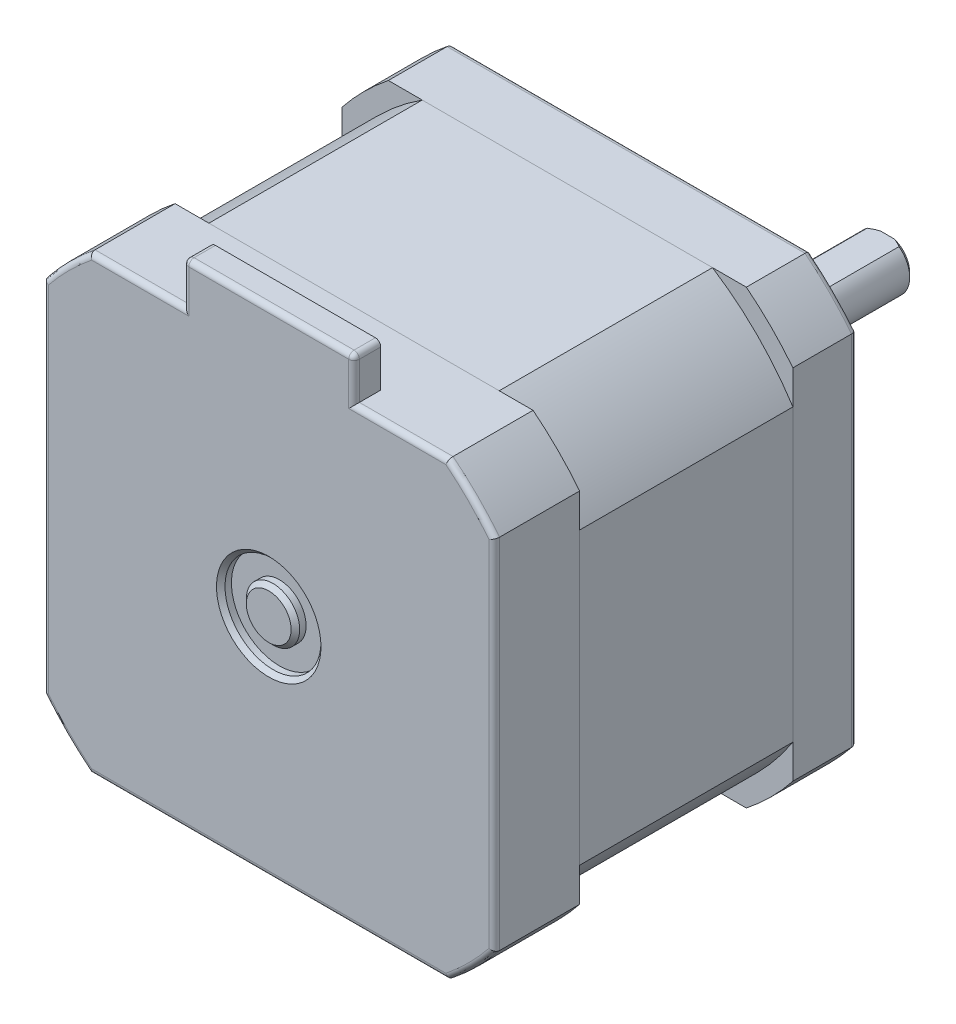
from build123d import *

# Parameters (mm, degrees)
BOSS_EXTRU_1_DEPTH           = 6
BOSS_EXTRU_2_DEPTH           = 20
BOSS_EXTRU_3_DEPTH           = 8
ESQUISSE4_W                  = 16
ESQUISSE4_H                  = 2.5
BOSS_EXTRU_4_DEPTH           = 4
ESQUISSE5_W                  = 2
ESQUISSE5_H                  = 6.5
ESQUISSE5_W_2                = 24
ESQUISSE5_H_2                = 2.5
CONG_1_R                     = 0.5
CONG_2_R                     = 0.5
CHANFREIN1_SIZE              = 0.4
CHANFREIN2_SIZE              = 0.4
ENL_V_MAT_EXTRU_1_DEPTH      = 48.284722808
ENL_V_MAT_EXTRU_1_DEPTH_BACK = 48.284722808
ESQUISSE6_W                  = 15
ESQUISSE6_H                  = 0.5
ESQUISSE7_R                  = 4.5
ESQUISSE7_R_2                = 2.5
ENL_V_MAT_EXTRU_2_DEPTH      = 1
CHANFREIN3_SIZE              = 0.4
TROU_TARAUD_M31_AT_2_COUNT   = 2
TROU_TARAUD_M31_AT_2_PITCH   = 31
TROU_TARAUD_M31_AT_3_COUNT   = 2
TROU_TARAUD_M31_AT_3_PITCH   = 43.840620434
TROU_TARAUD_M31_AT_4_COUNT   = 2
TROU_TARAUD_M31_AT_4_PITCH   = 31


with BuildPart() as part:
    # Esquisse1 → Boss.-Extru.1 (new body)
    with BuildSketch(Plane.XY):
        with BuildLine():
            Line((21.15, 16.783250579), (21.15, -16.783250579))
            ThreePointArc((21.15, -16.783250579), (19.091883092, -19.091883092), (16.783250579, -21.15))
            Line((16.783250579, -21.15), (-16.783250579, -21.15))
            ThreePointArc((-16.783250579, -21.15), (-19.091883092, -19.091883092), (-21.15, -16.783250579))
            Line((-21.15, -16.783250579), (-21.15, 16.783250579))
            ThreePointArc((-21.15, 16.783250579), (-19.091883092, 19.091883092), (-16.783250579, 21.15))
            Line((-16.783250579, 21.15), (16.783250579, 21.15))
            ThreePointArc((16.783250579, 21.15), (19.091883092, 19.091883092), (21.15, 16.783250579))
        make_face()
    extrude(amount=BOSS_EXTRU_1_DEPTH)

    # Congé2
    cong_2_edges = [part.edges().sort_by_distance(p)[0] for p in [
        (0, 21.15, 0),
        (19.091883092, 19.091883092, 0),
        (21.15, 0, 0),
        (19.091883092, -19.091883092, 0),
        (0, -21.15, 0),
        (-19.091883092, -19.091883092, 0),
        (-21.15, 0, 0),
        (-19.091883092, 19.091883092, 0),
    ]]
    fillet(cong_2_edges, radius=CONG_2_R)

    # Esquisse9 → Trou taraudé M31 (revolve, cut)
    with BuildSketch(Plane(origin=(15.5, -15.5, 0), x_dir=(0, 1, 0), z_dir=(1, 0, 0))):
        Polygon((0, 0), (0, 5.751075774), (1.25, 5), (1.25, 0), align=None)
    trou_taraud_m31 = revolve(axis=Axis((15.5, -15.5, -6.35), (0, 0, 1)), mode=Mode.SUBTRACT)

    # Trou taraudé M31 at 2: Trou taraudé M31 ×2
    with Locations(*[(0, i * TROU_TARAUD_M31_AT_2_PITCH, 0) for i in range(1, TROU_TARAUD_M31_AT_2_COUNT)]):
        add(trou_taraud_m31, mode=Mode.SUBTRACT)

    # Trou taraudé M31 at 3: Trou taraudé M31 ×2
    with Locations(*[Vector(-0.7071067811865476, 0.7071067811865476, 0) * (i * TROU_TARAUD_M31_AT_3_PITCH) for i in range(1, TROU_TARAUD_M31_AT_3_COUNT)]):
        add(trou_taraud_m31, mode=Mode.SUBTRACT)

    # Trou taraudé M31 at 4: Trou taraudé M31 ×2
    with Locations(*[(-i * TROU_TARAUD_M31_AT_4_PITCH, 0, 0) for i in range(1, TROU_TARAUD_M31_AT_4_COUNT)]):
        add(trou_taraud_m31, mode=Mode.SUBTRACT)


with BuildPart() as body_2:
    # Esquisse2 → Boss.-Extru.2 (new body)
    with BuildSketch(Plane.XY.offset(6)):
        with BuildLine():
            Line((-13.608820669, 21.15), (13.608820669, 21.15))
            ThreePointArc((13.608820669, 21.15), (17.783735547, 17.783735547), (21.15, 13.608820669))
            Line((21.15, 13.608820669), (21.15, -13.608820669))
            ThreePointArc((21.15, -13.608820669), (17.783735547, -17.783735547), (13.608820669, -21.15))
            Line((13.608820669, -21.15), (-13.608820669, -21.15))
            ThreePointArc((-13.608820669, -21.15), (-17.783735547, -17.783735547), (-21.15, -13.608820669))
            Line((-21.15, -13.608820669), (-21.15, 13.608820669))
            ThreePointArc((-21.15, 13.608820669), (-17.783735547, 17.783735547), (-13.608820669, 21.15))
        make_face()
    extrude(amount=BOSS_EXTRU_2_DEPTH)


with BuildPart() as body_3:
    # Esquisse3 → Boss.-Extru.3 (new body)
    with BuildSketch(Plane.XY.offset(26)):
        with BuildLine():
            Line((-16.783250579, -21.15), (16.783250579, -21.15))
            ThreePointArc((16.783250579, -21.15), (19.091883092, -19.091883092), (21.15, -16.783250579))
            Line((21.15, -16.783250579), (21.15, 16.783250579))
            ThreePointArc((21.15, 16.783250579), (19.091883092, 19.091883092), (16.783250579, 21.15))
            Line((16.783250579, 21.15), (-16.783250579, 21.15))
            ThreePointArc((-16.783250579, 21.15), (-19.091883092, 19.091883092), (-21.15, 16.783250579))
            Line((-21.15, 16.783250579), (-21.15, -16.783250579))
            ThreePointArc((-21.15, -16.783250579), (-19.091883092, -19.091883092), (-16.783250579, -21.15))
        make_face()
    extrude(amount=BOSS_EXTRU_3_DEPTH)

    # Esquisse4 → Boss.-Extru.4 (add)
    with BuildSketch(Plane(origin=(0, 21.15, 0), x_dir=(1, 0, 0), z_dir=(0, 1, 0))):
        with Locations((0, -32.75)):
            Rectangle(ESQUISSE4_W, ESQUISSE4_H)
    extrude(amount=BOSS_EXTRU_4_DEPTH)

    # Congé1
    cong_1_edges = [body_3.edges().sort_by_distance(p)[0] for p in [
        (19.091883092, -19.091883092, 34),
        (21.15, 0, 34),
        (19.091883092, 19.091883092, 34),
        (12.39162529, 21.15, 34),
        (-19.091883092, 19.091883092, 34),
        (-12.39162529, 21.15, 34),
        (-21.15, 0, 34),
        (8, 23.15, 34),
        (-8, 23.15, 34),
        (8, 25.15, 32.75),
        (-8, 25.15, 32.75),
        (0, 25.15, 34),
        (-19.091883092, -19.091883092, 34),
        (0, -21.15, 34),
    ]]
    fillet(cong_1_edges, radius=CONG_1_R)

    # Esquisse7 → Enlèv. mat.-Extru.2 (cut)
    with BuildSketch(Plane.XY.offset(34)):
        with Locations(Location((0, 0, 0), (0, 0, 180))):
            Circle(ESQUISSE7_R)
        with Locations(Location((0, 0, 0), (0, 0, 180))):
            Circle(ESQUISSE7_R_2, mode=Mode.SUBTRACT)
    extrude(amount=-ENL_V_MAT_EXTRU_2_DEPTH, mode=Mode.SUBTRACT)

    # Chanfrein3
    chanfrein3_edges = [body_3.edges().sort_by_distance(p)[0] for p in [
        (4.5, 0, 34),
        (2.5, 0, 34),
    ]]
    chamfer(chanfrein3_edges, length=CHANFREIN3_SIZE)


with BuildPart() as body_4:
    # Esquisse5 → Révolution1 (revolve)
    with BuildSketch(Plane(origin=(0, 0, 0), x_dir=(0, 0, -1), z_dir=(1, 0, 0)), mode=Mode.PRIVATE) as r_volution1_sk:
        with Locations((1, 7.75)):
            Rectangle(ESQUISSE5_W, ESQUISSE5_H)
        with Locations((12, 1.25)):
            Rectangle(ESQUISSE5_W_2, ESQUISSE5_H_2)
    revolve(r_volution1_sk.sketch.rotate(Axis((0, 0, 0), (0, 0, 1)), 90), axis=Axis((0, 0, 0), (0, 0, 1)))

    # Chanfrein1
    chanfrein1_edges = [body_4.edges().sort_by_distance(p)[0] for p in [
        (2.5, 0, -24),
    ]]
    chamfer(chanfrein1_edges, length=CHANFREIN1_SIZE)

    # Chanfrein2
    chanfrein2_edges = [body_4.edges().sort_by_distance(p)[0] for p in [
        (11, 0, -2),
        (4.5, 0, -2),
    ]]
    chamfer(chanfrein2_edges, length=CHANFREIN2_SIZE)

    # Esquisse6 → Enlèv. mat.-Extru.1 (cut, two sides: drawn at the far end of the back side and taken through both)
    with BuildSketch(Plane(origin=(0, 0, 0), x_dir=(0, 0, -1), z_dir=(1, 0, 0)).offset(-ENL_V_MAT_EXTRU_1_DEPTH_BACK)):
        with Locations((16.5, 2.25)):
            Rectangle(ESQUISSE6_W, ESQUISSE6_H)
    extrude(amount=ENL_V_MAT_EXTRU_1_DEPTH + ENL_V_MAT_EXTRU_1_DEPTH_BACK, mode=Mode.SUBTRACT)


solid = Compound([part.part, body_2.part, body_3.part, body_4.part])
